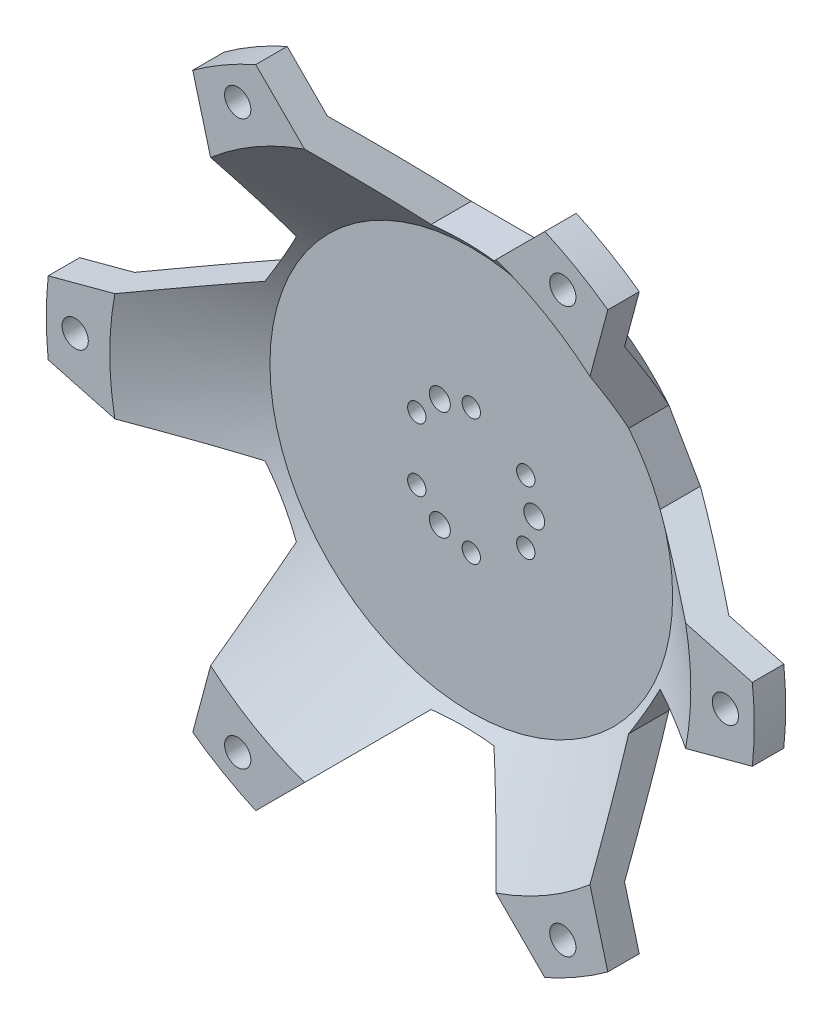
from build123d import *

# Parameters (mm, degrees)
CUT_EXTRUDE15_DEPTH      = 97.415368098
CUT_EXTRUDE15_DEPTH_BACK = 97.415368098
SKETCH53_R               = 2.5
CUT_EXTRUDE16_DEPTH      = 93.391600197
SKETCH88_R               = 1.75
SKETCH88_R_2             = 2
CUT_EXTRUDE17_DEPTH      = 94.459768752


with BuildPart() as part:
    # Sketch51 → Revolve2 (revolve)
    with BuildSketch(Plane(origin=(0, 0, 0), x_dir=(0, 0, -1), z_dir=(1, 0, 0)), mode=Mode.PRIVATE) as revolve2_sk:
        Polygon((-13.54338235, 57.5), (0, 40.5), (0, 0), (-6, 0), (-6, 38.402164253), (-19.54338235, 55.402164253), (-19.54338235, 67.5), (-13.54338235, 67.5), align=None)
    revolve(revolve2_sk.sketch.rotate(Axis((0, 0, 0), (0, 0, -1)), 90), axis=Axis((0, 0, 0), (0, 0, -1)))

    # Sketch52 → Cut-Extrude15 (cut, two sides: drawn at the far end of the back side and taken through both)
    with BuildSketch(Plane(origin=(0, 0, 13.54338235), x_dir=(-1, 0, 0), z_dir=(0, 0, -1)).offset(-CUT_EXTRUDE15_DEPTH_BACK)):
        Polygon((-37.295847234, 71.348937003), (-6, 40.053089768), (6, 40.053089768), (37.295847234, 71.348937003), align=None)
        Polygon((31.68699324, 25.222697307), (37.68699324, 14.830392462), (80.437915594, 3.375317341), (43.14206836, 67.973619662), align=None)
        Polygon((37.68699324, -14.830392462), (31.68699324, -25.222697307), (43.14206836, -67.973619662), (80.437915594, -3.375317341), align=None)
        Polygon((6, -40.053089768), (-6, -40.053089768), (-37.295847234, -71.348937003), (37.295847234, -71.348937003), align=None)
        Polygon((-31.68699324, -25.222697307), (-37.68699324, -14.830392462), (-80.437915594, -3.375317341), (-43.14206836, -67.973619662), align=None)
        Polygon((-37.68699324, 14.830392462), (-31.68699324, 25.222697307), (-43.14206836, 67.973619662), (-80.437915594, 3.375317341), align=None)
    extrude(amount=CUT_EXTRUDE15_DEPTH + CUT_EXTRUDE15_DEPTH_BACK, mode=Mode.SUBTRACT)

    # Sketch53 → Cut-Extrude16 (cut, through all)
    with BuildSketch(Plane(origin=(0, 0, 13.54338235), x_dir=(-1, 0, 0), z_dir=(0, 0, -1))):
        with Locations((62, 0)):
            Circle(SKETCH53_R)
        with Locations((31, -53.693575035)):
            Circle(SKETCH53_R)
        with Locations((-31, -53.693575035)):
            Circle(SKETCH53_R)
        with Locations((-62, 0)):
            Circle(SKETCH53_R)
        with Locations((-31, 53.693575035)):
            Circle(SKETCH53_R)
        with Locations((31, 53.693575035)):
            Circle(SKETCH53_R)
    extrude(amount=-CUT_EXTRUDE16_DEPTH, mode=Mode.SUBTRACT)

    # Sketch88 → Cut-Extrude17 (cut, through all)
    with BuildSketch(Plane(origin=(0, 0, 0), x_dir=(-1, 0, 0), z_dir=(0, 0, -1))):
        with Locations((0, 12)):
            Circle(SKETCH88_R)
        with Locations((10.392304845, 6)):
            Circle(SKETCH88_R)
        with Locations((10.392304845, -6)):
            Circle(SKETCH88_R)
        with Locations((0, -12)):
            Circle(SKETCH88_R)
        with Locations((-10.392304845, -6)):
            Circle(SKETCH88_R)
        with Locations((-10.392304845, 6)):
            Circle(SKETCH88_R)
        with Locations((6, -10.392304845)):
            Circle(SKETCH88_R_2)
        with Locations((-12, 0)):
            Circle(SKETCH88_R_2)
        with Locations((6, 10.392304845)):
            Circle(SKETCH88_R_2)
    extrude(amount=-CUT_EXTRUDE17_DEPTH, mode=Mode.SUBTRACT)


solid = part.part
